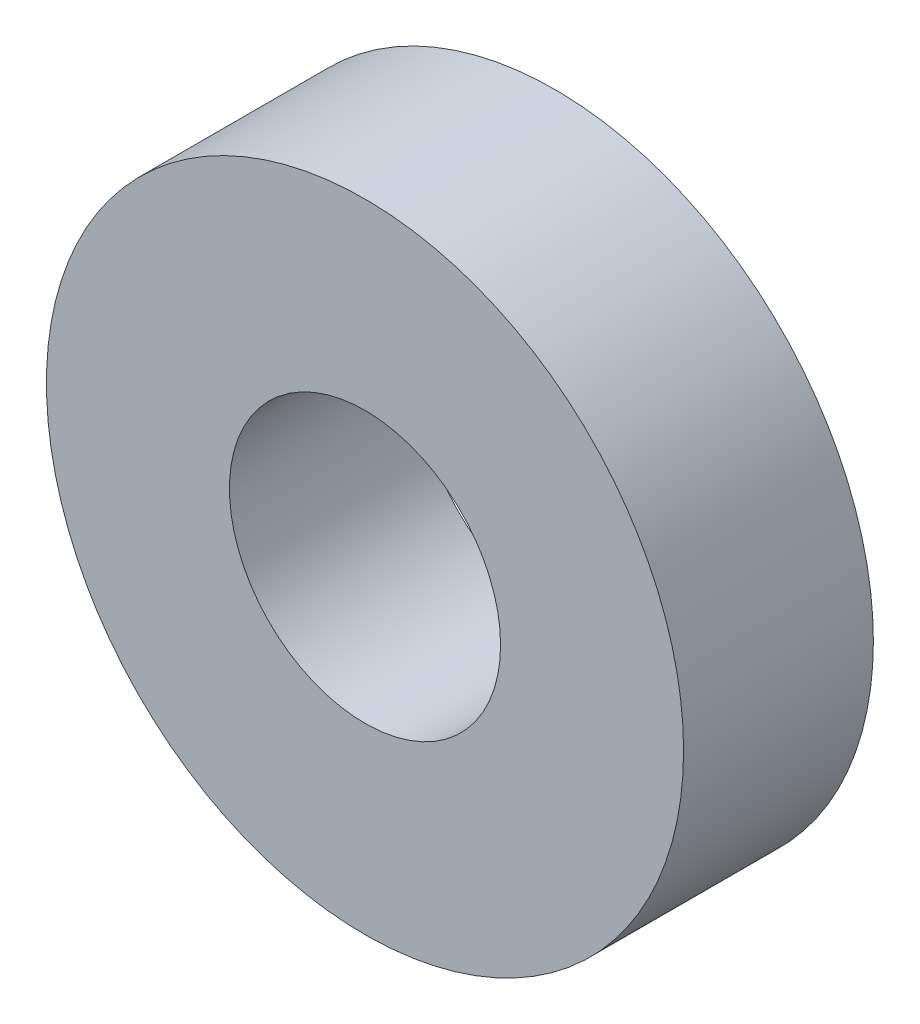
from build123d import *

# Parameters (mm, degrees)
PURCHASED_BEARING_ENVELOPE_START = -45
SKETCH_1_R                       = 23.5
SKETCH_1_R_2                     = 10
PURCHASED_BEARING_ENVELOPE_DEPTH = 14


with BuildPart() as part:
    # Эскиз1 → Purchased_bearing_envelope (new body)
    with BuildSketch(Plane.XY.offset(PURCHASED_BEARING_ENVELOPE_START)):
        Circle(SKETCH_1_R)
        Circle(SKETCH_1_R_2, mode=Mode.SUBTRACT)
    extrude(amount=PURCHASED_BEARING_ENVELOPE_DEPTH)


solid = part.part
